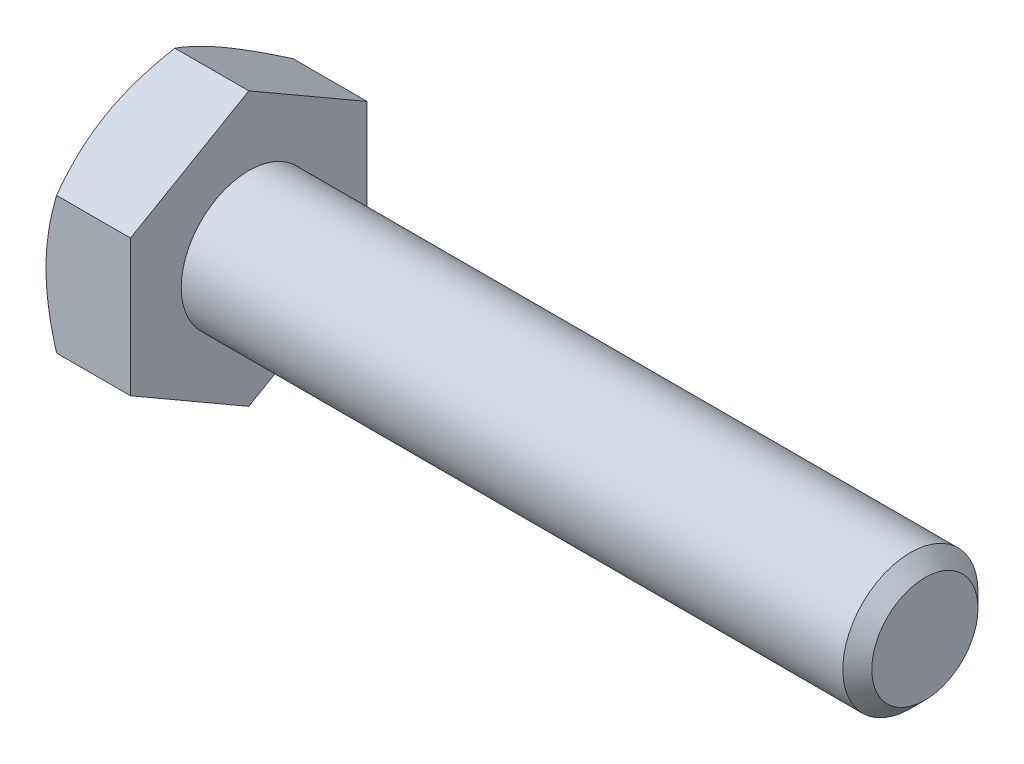
from build123d import *

# Parameters (mm, degrees)
SKETCH5_R           = 3.175
BOSS_EXTRUDE3_DEPTH = 31.75
CHAMFER1_SIZE       = 0.680357143
BOSS_EXTRUDE4_DEPTH = 3.96875
SKETCH8_OUTSIDE_W   = 151.664
SKETCH8_OUTSIDE_H   = 153.384
SKETCH8_OUTSIDE_R   = 5.55625
CUT_EXTRUDE3_DEPTH  = 37.713261469
CUT_EXTRUDE3_DRAFT  = -60
CUT_EXTRUDE4_DEPTH  = 0.254
CIRPATTERN1_COUNT   = 3


with BuildPart() as part:
    # Sketch5 → Boss-Extrude3 (new body)
    with BuildSketch(Plane(origin=(17.859375, 0, 0), x_dir=(0, 0, -1), z_dir=(1, 0, 0))):
        Circle(SKETCH5_R)
    extrude(amount=-BOSS_EXTRUDE3_DEPTH)

    # Chamfer1
    chamfer1_edges = [part.edges().sort_by_distance(p)[0] for p in [
        (17.859375, 0, 3.175),
    ]]
    chamfer(chamfer1_edges, length=CHAMFER1_SIZE)

    # Sketch6 → Boss-Extrude4 (add)
    with BuildSketch(Plane.ZY.offset(13.890625)):
        Polygon((5.55625, 3.207902433), (0, 6.415804866), (-5.55625, 3.207902433), (-5.55625, -3.207902433), (0, -6.415804866), (5.55625, -3.207902433), align=None)
    extrude(amount=BOSS_EXTRUDE4_DEPTH)


with BuildPart() as cut_extrude3_tool:
    # Sketch8 outside → Cut-Extrude3 (with draft: the straight prism first)
    with BuildSketch(Plane.ZY.offset(17.859375)):
        Rectangle(SKETCH8_OUTSIDE_W, SKETCH8_OUTSIDE_H)
        Circle(SKETCH8_OUTSIDE_R, mode=Mode.SUBTRACT)
    extrude(amount=-CUT_EXTRUDE3_DEPTH)
    # Cut-Extrude3: the draft: its side faces are tilted about the plane it starts from
    cut_extrude3_sides = [cut_extrude3_tool.faces().sort_by_distance(p)[0] for p in [
        (0.997255735, -76.692, 0),
        (0.997255735, 0, 75.832),
        (0.997255735, 76.692, 0),
        (0.997255735, 0, -75.832),
        (0.997255735, 0, -5.55625),
    ]]
    draft(cut_extrude3_sides, Plane.ZY.offset(17.859375), CUT_EXTRUDE3_DRAFT)


with BuildPart() as part_1:
    add(part.part)

    # Cut-Extrude3: cut by cut_extrude3_tool
    add(cut_extrude3_tool.part, mode=Mode.SUBTRACT)

    # Sketch12 → Cut-Extrude4 (cut)
    with BuildSketch(Plane.ZY.offset(17.859375)):
        with BuildLine():
            Line((0.1666875, 4.2783125), (0.1666875, 2.3891875))
            ThreePointArc((0.1666875, 2.3891875), (0, 2.2225), (-0.1666875, 2.3891875))
            Line((-0.1666875, 2.3891875), (-0.1666875, 4.2783125))
            ThreePointArc((-0.1666875, 4.2783125), (0, 4.445), (0.1666875, 4.2783125))
        make_face()
    cut_extrude4 = extrude(amount=-CUT_EXTRUDE4_DEPTH, mode=Mode.SUBTRACT)

    # CirPattern1: Cut-Extrude4 ×3 about axis
    cirpattern1_axis = Axis((0, 0, 0), (1, 0, 0))
    for i in range(1, CIRPATTERN1_COUNT):
        add(cut_extrude4.rotate(cirpattern1_axis, i * 360 / CIRPATTERN1_COUNT), mode=Mode.SUBTRACT)


solid = part_1.part
